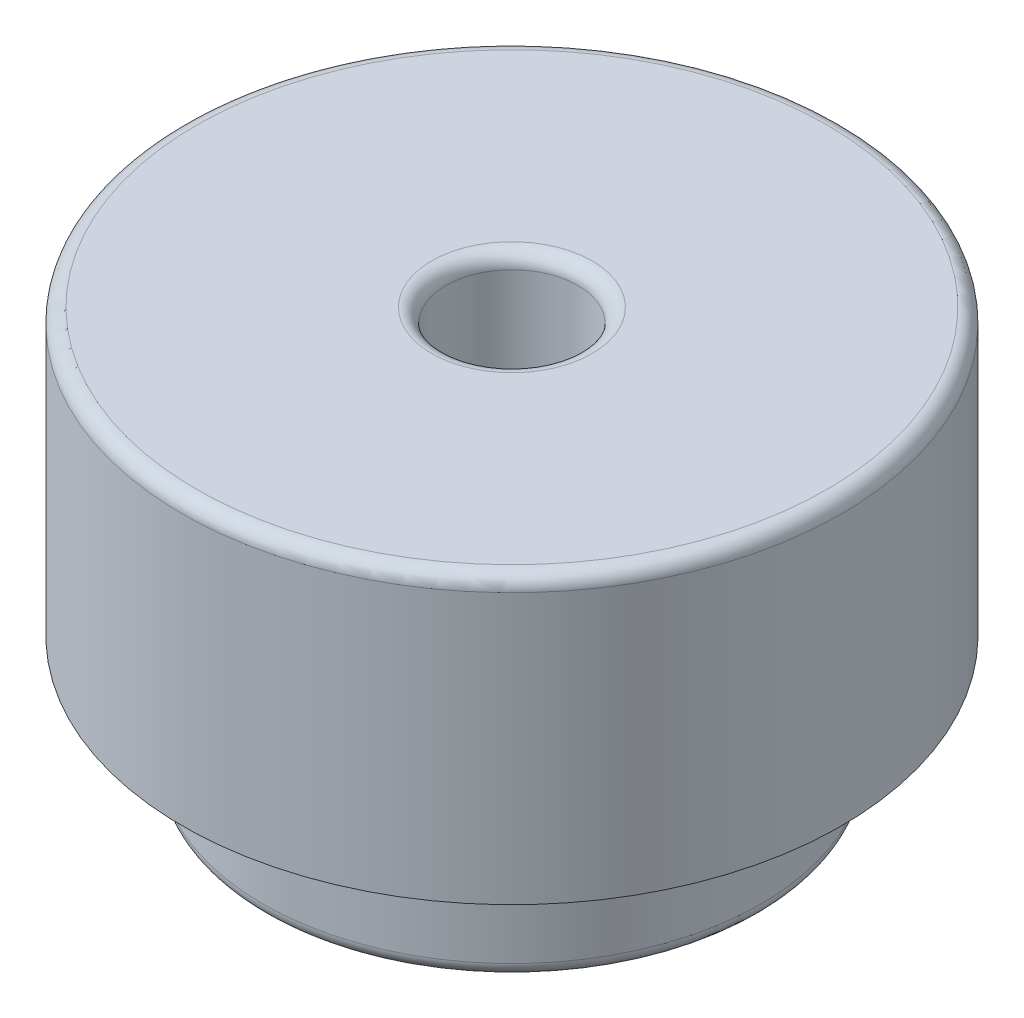
from build123d import *


with BuildPart() as part:
    # Sketch1 → Revolve1 (revolve)
    with BuildSketch(Plane.XY, mode=Mode.PRIVATE) as revolve1_sk:
        with BuildLine():
            Line((4.9101, -8.033333329), (4.9101, 20.085714286))
            ThreePointArc((4.9101, 20.085714286), (5.219729974, 20.833227169), (5.967242857, 21.142857143))
            Line((5.967242857, 21.142857143), (23.442857143, 21.142857143))
            ThreePointArc((23.442857143, 21.142857143), (24.190370026, 20.833227169), (24.5, 20.085714286))
            Line((24.5, 20.085714286), (24.5, 0))
            Line((24.5, 0), (18.941146179, 0))
            ThreePointArc((18.941146179, 0), (18.629208724, -0.129208724), (18.5, -0.441146179))
            Line((18.5, -0.441146179), (18.5, -8.033333329))
            ThreePointArc((18.5, -8.033333329), (18.190370026, -8.780846212), (17.442857143, -9.090476186))
            Line((17.442857143, -9.090476186), (5.967242857, -9.090476186))
            ThreePointArc((5.967242857, -9.090476186), (5.219729974, -8.780846212), (4.9101, -8.033333329))
        make_face()
    revolve(revolve1_sk.sketch.rotate(Axis((0, 0, 0), (0, 1, 0)), 90), axis=Axis((0, 0, 0), (0, 1, 0)))


solid = part.part
